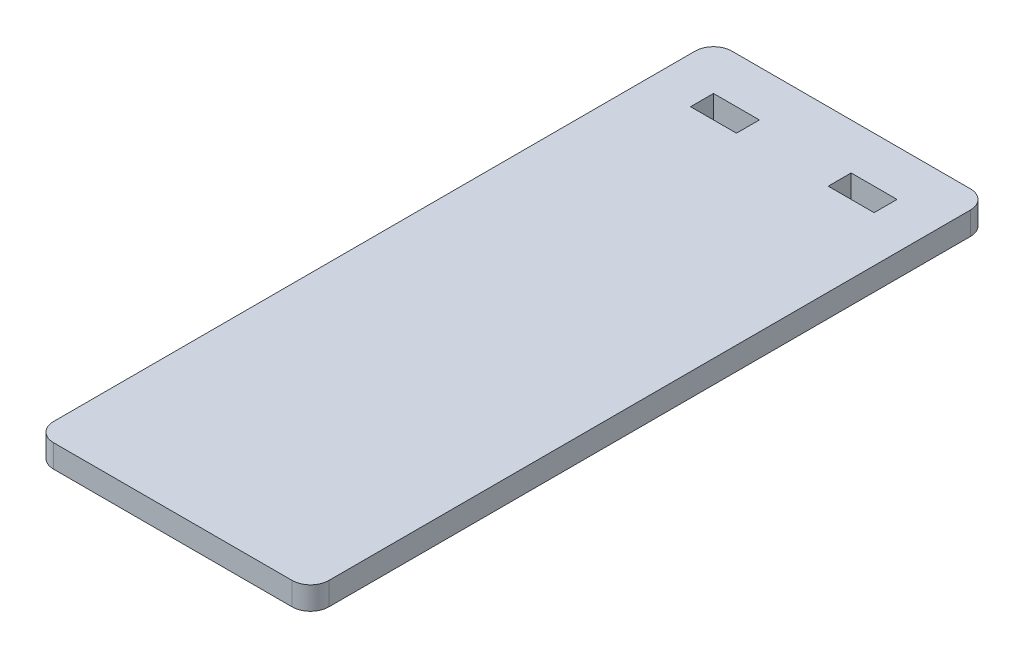
from build123d import *

# Parameters (mm, degrees)
SKETCH1_W           = 38.1
SKETCH1_H           = 93.875
BOSS_EXTRUDE1_DEPTH = 3.175
SKETCH2_W           = 6.35
SKETCH2_H           = 3.175
CUT_EXTRUDE1_DEPTH  = 102.361759308
FILLET1_R           = 2.54


with BuildPart() as part:
    # Sketch1 → Boss-Extrude1 (new body)
    with BuildSketch(Plane(origin=(0, 0, 0), x_dir=(1, 0, 0), z_dir=(0, 1, 0))):
        with Locations((19.05, 46.9375)):
            Rectangle(SKETCH1_W, SKETCH1_H)
    extrude(amount=BOSS_EXTRUDE1_DEPTH)

    # Sketch2 → Cut-Extrude1 (cut, through all)
    with BuildSketch(Plane(origin=(0, 3.175, 0), x_dir=(1, 0, 0), z_dir=(0, 1, 0))):
        with Locations((9.525, 85.9375)):
            Rectangle(SKETCH2_W, SKETCH2_H)
        with Locations((28.575, 85.9375)):
            Rectangle(SKETCH2_W, SKETCH2_H)
    extrude(amount=-CUT_EXTRUDE1_DEPTH, mode=Mode.SUBTRACT)

    # Fillet1
    fillet1_edges = [part.edges().sort_by_distance(p)[0] for p in [
        (0, 1.5875, -93.875),
        (38.1, 1.5875, -93.875),
        (38.1, 1.5875, 0),
        (0, 1.5875, 0),
    ]]
    fillet(fillet1_edges, radius=FILLET1_R)


solid = part.part
